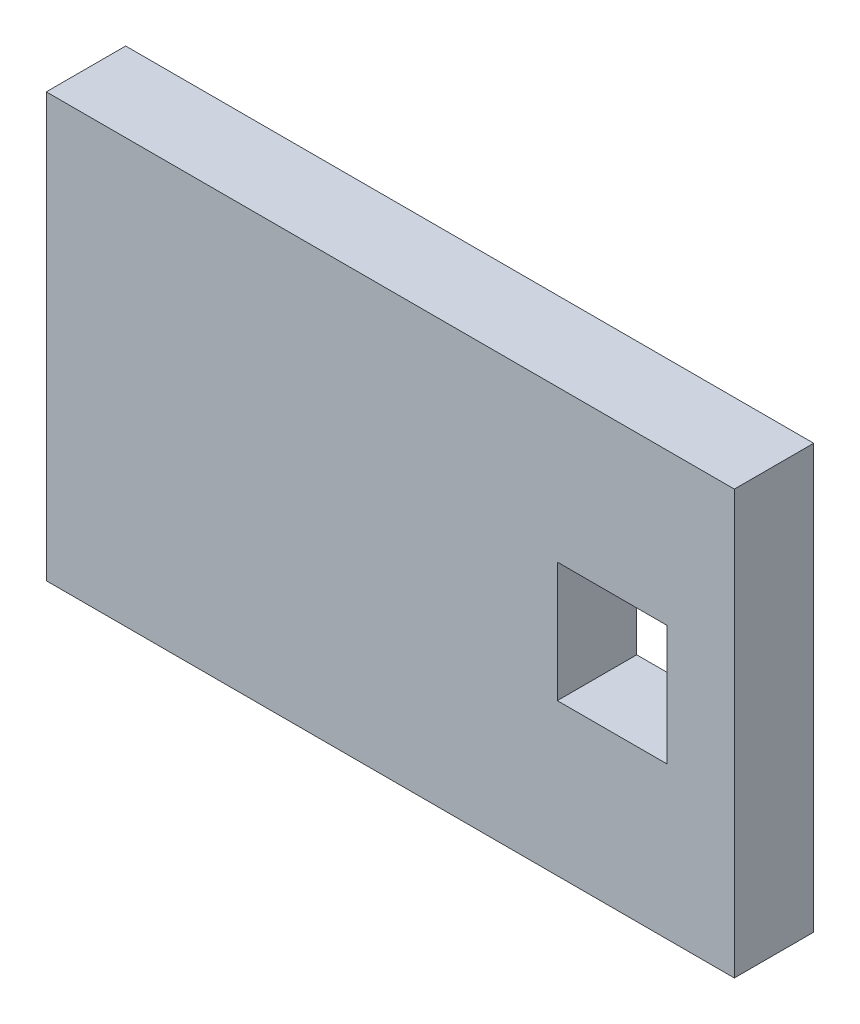
from build123d import *

# Parameters (mm, degrees)
IZIM1_W                     = 26
IZIM1_H                     = 16
IZIM1_R                     = 2.072340414
Y_KSEKLIK_EKSTR_ZYON1_DEPTH = 3
IZIM2_W                     = 4.147814154
IZIM2_H                     = 4.535167944
KES_EKSTR_ZYON1_DEPTH       = 10


with BuildPart() as part:
    # Çizim1 → Yükseklik-Ekstrüzyon1 (new body)
    with BuildSketch(Plane.XY):
        Rectangle(IZIM1_W, IZIM1_H)
        with Locations((8.385515416, 0)):
            Circle(IZIM1_R, mode=Mode.SUBTRACT)
    extrude(amount=Y_KSEKLIK_EKSTR_ZYON1_DEPTH)

    # Çizim2 → Kes-Ekstrüzyon1 (cut)
    with BuildSketch(Plane.XY.offset(3)):
        with Locations((8.385515416, 0)):
            Rectangle(IZIM2_W, IZIM2_H)
    extrude(amount=-KES_EKSTR_ZYON1_DEPTH, mode=Mode.SUBTRACT)


solid = part.part
